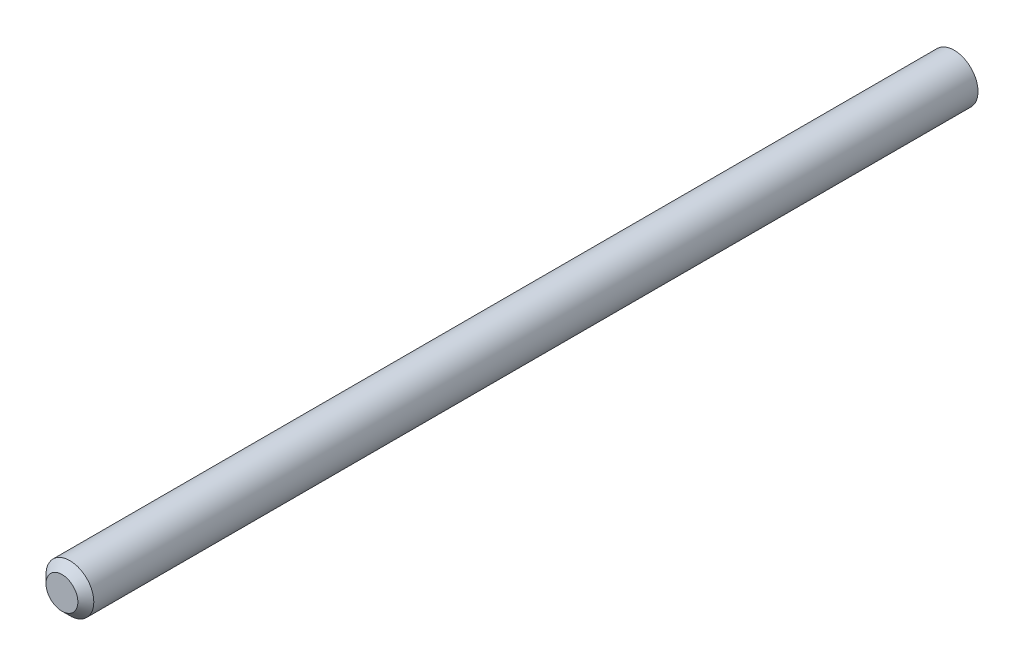
from build123d import *

# Parameters (mm, degrees)
SKETCH1_R           = 9.525
BOSS_EXTRUDE1_DEPTH = 355.6
CHAMFER1_SIZE       = 3.175


with BuildPart() as part:
    # Sketch1 → Boss-Extrude1 (new body)
    with BuildSketch(Plane.XY):
        Circle(SKETCH1_R)
    extrude(amount=BOSS_EXTRUDE1_DEPTH)

    # Chamfer1
    chamfer1_edges = [part.edges().sort_by_distance(p)[0] for p in [
        (-9.525, 0, 355.6),
    ]]
    chamfer(chamfer1_edges, length=CHAMFER1_SIZE)


solid = part.part
